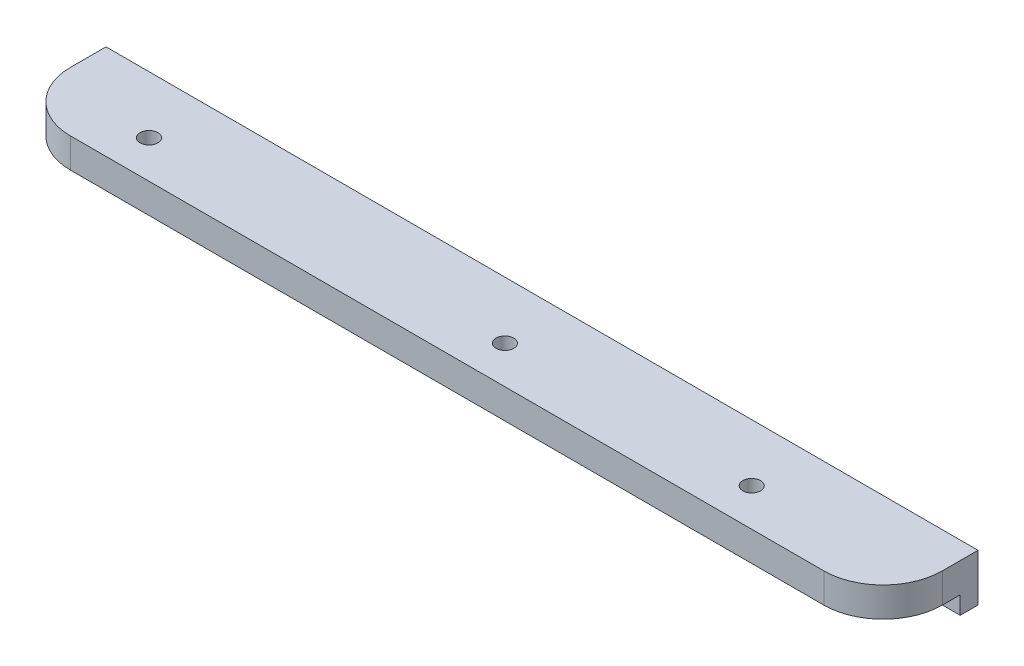
from build123d import *

# Parameters (mm, degrees)
BOSS_EXTRUDE1_DEPTH  = 5
SKETCH3_W            = 147
SKETCH3_H            = 3
BOSS_EXTRUDE2_DEPTH  = 3
FILLET1_R            = 10
FILLET2_R            = 10
FILLET1_OF_MIRROR2_R = 10
FILLET2_OF_MIRROR2_R = 10
SKETCH4_W            = 194.268756053
SKETCH4_H            = 72.725923545
CUT_EXTRUDE1_DEPTH   = 10
SKETCH5_W            = 171.335510382
SKETCH5_H            = 74.648887474
CUT_EXTRUDE3_DEPTH   = 8


with BuildPart() as part:
    # Sketch2 → Boss-Extrude1 (new body)
    with BuildSketch(Plane(origin=(0, 0, 0), x_dir=(1, 0, 0), z_dir=(0, 1, 0))):
        Polygon((51.332898172, 11.229765013), (79.832898172, 11.229765013), (79.832898172, 37.229765013), (-67.167101828, 37.229765013), (-67.167101828, 11.229765013), (-50.267101828, 11.229765013), (9.722898172, 11.229765013), align=None)
        with BuildLine():
            ThreePointArc((-48.767101828, 17.579765013), (-49.206441656, 16.519104841), (-50.267101828, 16.079765013))
            ThreePointArc((-50.267101828, 16.079765013), (-51.327761999, 18.640425185), (-48.767101828, 17.579765013))
        make_face(mode=Mode.SUBTRACT)
        with BuildLine():
            ThreePointArc((11.222898172, 17.579765013), (9.722898172, 16.079765013), (8.222898172, 17.579765013))
            ThreePointArc((8.222898172, 17.579765013), (9.722898172, 19.079765013), (11.222898172, 17.579765013))
        make_face(mode=Mode.SUBTRACT)
        with BuildLine():
            ThreePointArc((52.832898172, 17.579765013), (51.332898172, 16.079765013), (49.832898172, 17.579765013))
            ThreePointArc((49.832898172, 17.579765013), (51.332898172, 19.079765013), (52.832898172, 17.579765013))
        make_face(mode=Mode.SUBTRACT)
    boss_extrude1 = extrude(amount=BOSS_EXTRUDE1_DEPTH)

    # Sketch3 → Boss-Extrude2 (add)
    with BuildSketch(Plane(origin=(0, 5, 0), x_dir=(1, 0, 0), z_dir=(0, 1, 0))):
        with Locations((6.332898172, 25.729765013)):
            Rectangle(SKETCH3_W, SKETCH3_H)
    boss_extrude2 = extrude(amount=BOSS_EXTRUDE2_DEPTH)

    # Fillet1
    fillet1_edges = [part.edges().sort_by_distance(p)[0] for p in [
        (-67.167101828, 2.5, -11.229765013),
        (-67.167101828, 2.5, -37.229765013),
    ]]
    fillet(fillet1_edges, radius=FILLET1_R)

    # Fillet2
    fillet2_edges = [part.edges().sort_by_distance(p)[0] for p in [
        (79.832898172, 2.5, -11.229765013),
        (79.832898172, 2.5, -37.229765013),
    ]]
    fillet(fillet2_edges, radius=FILLET2_R)


with BuildPart() as mirror2_1:
    # Mirror2: Boss-Extrude1, Boss-Extrude2 across plane
    add(boss_extrude1.mirror(Plane.ZX))
    add(boss_extrude2.mirror(Plane.ZX))

    # Fillet1 of Mirror2
    fillet1_of_mirror2_edges = [mirror2_1.edges().sort_by_distance(p)[0] for p in [
        (-67.167101828, -2.5, -11.229765013),
        (-67.167101828, -2.5, -37.229765013),
    ]]
    fillet(fillet1_of_mirror2_edges, radius=FILLET1_OF_MIRROR2_R)

    # Fillet2 of Mirror2
    fillet2_of_mirror2_edges = [mirror2_1.edges().sort_by_distance(p)[0] for p in [
        (79.832898172, -2.5, -11.229765013),
        (79.832898172, -2.5, -37.229765013),
    ]]
    fillet(fillet2_of_mirror2_edges, radius=FILLET2_OF_MIRROR2_R)


with BuildPart() as part_1:
    add(part.part)

    # Mirror2 united with what the copies touc: union Mirror2_1
    add(mirror2_1.part)

    # Sketch4 → Cut-Extrude1 (cut)
    with BuildSketch(Plane(origin=(0, 0, -37.229765013), x_dir=(-1, 0, 0), z_dir=(0, 0, -1))):
        with Locations((1.63687335, -5.593113251)):
            Rectangle(SKETCH4_W, SKETCH4_H)
    extrude(amount=-CUT_EXTRUDE1_DEPTH, mode=Mode.SUBTRACT)

    # Sketch5 → Cut-Extrude3 (cut)
    with BuildSketch(Plane(origin=(0, 8, 0), x_dir=(1, 0, 0), z_dir=(0, 1, 0))):
        with Locations((6.60212353, 21.504384846)):
            Rectangle(SKETCH5_W, SKETCH5_H)
    extrude(amount=-CUT_EXTRUDE3_DEPTH, mode=Mode.SUBTRACT)


solid = part_1.part
